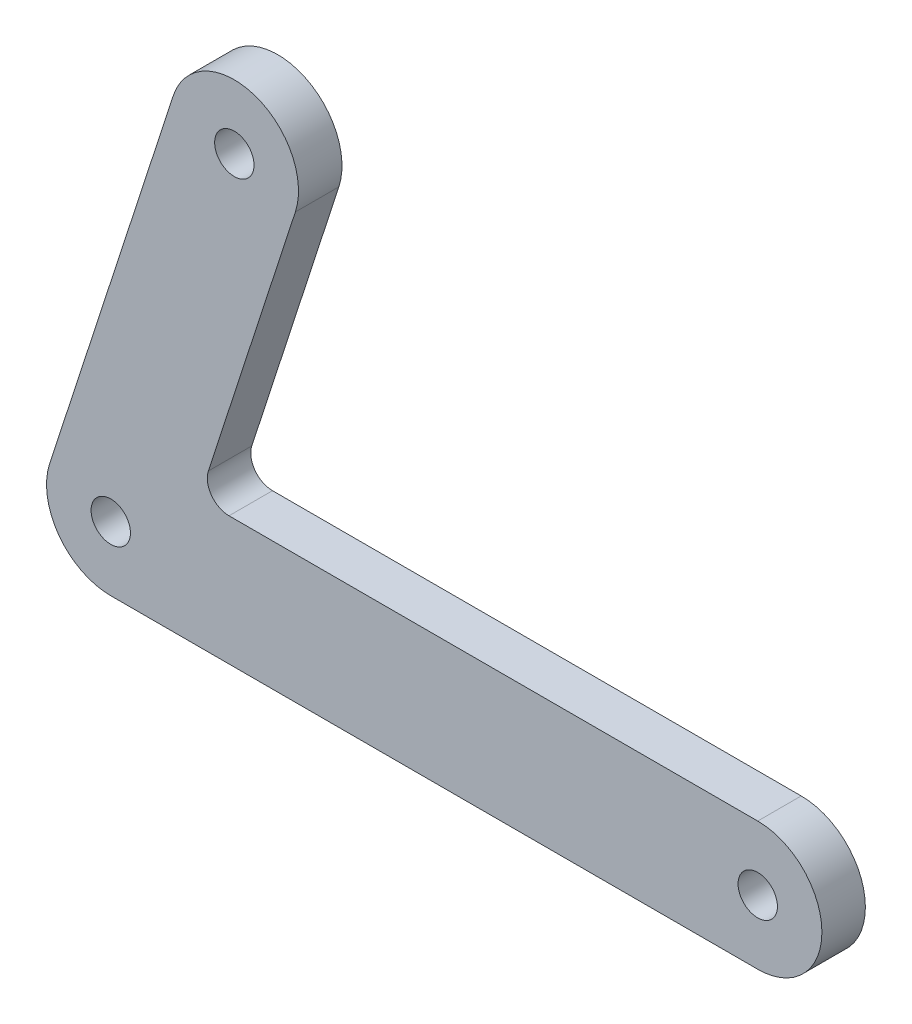
from build123d import *

# Parameters (mm, degrees)
BOSS_EXTRUDE1_DEPTH = 5.08


with BuildPart() as part:
    # Sketch1 → Boss-Extrude1 (new body)
    with BuildSketch(Plane.XY):
        with BuildLine():
            ThreePointArc((50.8526553, 100.196470122), (51.917951715, 93.470453272), (57.985579172, 90.378842665))
            Line((57.985579172, 90.378842665), (133.585579172, 90.378842665))
            ThreePointArc((133.585579172, 90.378842665), (138.888880031, 92.575541806), (141.085579172, 97.878842665))
            ThreePointArc((141.085579172, 97.878842665), (138.888880031, 103.182143524), (133.585579172, 105.378842665))
            Line((133.585579172, 105.378842665), (71.804453654, 105.378842665))
            ThreePointArc((71.804453654, 105.378842665), (69.749550488, 106.425868124), (69.388770103, 108.70374583))
            Line((69.388770103, 108.70374583), (79.55681827, 139.99778028))
            ThreePointArc((79.55681827, 139.99778028), (74.741521855, 149.44833161), (65.290970525, 144.633035196))
            Line((65.290970525, 144.633035196), (50.8526553, 100.196470122))
        make_face()
        with BuildLine():
            ThreePointArc((60.285579172, 97.878842665), (57.985579172, 95.578842665), (55.685579172, 97.878842665))
            ThreePointArc((55.685579172, 97.878842665), (57.985579172, 100.178842665), (60.285579172, 97.878842665))
        make_face(mode=Mode.SUBTRACT)
        with BuildLine():
            ThreePointArc((135.885579172, 97.878842665), (133.585579172, 95.578842665), (131.285579172, 97.878842665))
            ThreePointArc((131.285579172, 97.878842665), (133.585579172, 100.178842665), (135.885579172, 97.878842665))
        make_face(mode=Mode.SUBTRACT)
        with BuildLine():
            ThreePointArc((74.611324385, 141.604668651), (71.713155311, 140.12797775), (70.23646441, 143.026146825))
            ThreePointArc((70.23646441, 143.026146825), (73.134633485, 144.502837725), (74.611324385, 141.604668651))
        make_face(mode=Mode.SUBTRACT)
    extrude(amount=BOSS_EXTRUDE1_DEPTH)


solid = part.part
